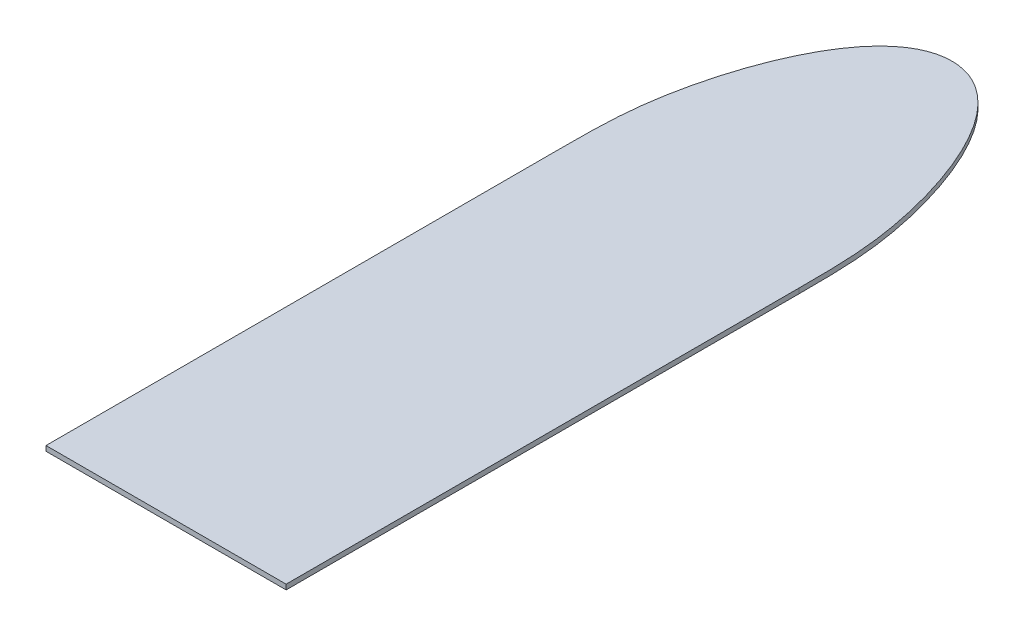
from build123d import *

# Parameters (mm, degrees)
BOSS_EXTRUDE1_DEPTH = 5.842
SKETCH4_W           = 139.7
SKETCH4_H           = 927.1
CUT_EXTRUDE1_DEPTH  = 1468.177722461


with BuildPart() as part:
    # Sketch3 → Boss-Extrude1 (new body)
    with BuildSketch(Plane(origin=(0, 0, 0), x_dir=(1, 0, 0), z_dir=(0, 1, 0))):
        with BuildLine():
            Line((0, 381), (0, -1460.5))
            add(Edge.make_bspline(
                [(0, -1460.5), (108.684994241, -1460.5), (137.201191705, -1361.385263755), (139.7, -1312.037784968), (139.7, -1270)],
                knots=[0, 0, 0, 0, 0.140310505, 0.200610012, 0.200610012, 0.200610012, 0.200610012], degree=3))
            Line((139.7, -1270), (139.7, 63.5))
            add(Edge.make_bspline(
                [(139.7, 63.5), (139.7, 105.409860509), (138.775867716, 206.495657368), (73.507849515, 381), (0, 381)],
                knots=[0.803817555, 0.803817555, 0.803817555, 0.803817555, 0.866735408, 1, 1, 1, 1], degree=3))
        make_face()
    extrude(amount=BOSS_EXTRUDE1_DEPTH)

    # Sketch4 → Cut-Extrude1 (cut, through all)
    with BuildSketch(Plane(origin=(0, 0, 0), x_dir=(1, 0, 0), z_dir=(0, 1, 0))):
        with Locations((69.85, -996.95)):
            Rectangle(SKETCH4_W, SKETCH4_H)
    extrude(amount=CUT_EXTRUDE1_DEPTH, mode=Mode.SUBTRACT)

    # Mirror1: part across plane


with BuildPart() as part_1:
    add(part.part)
    add(part.part.mirror(Plane(origin=(0, 0, 0), x_dir=(0, 0, 1), z_dir=(1, 0, 0))))


solid = part_1.part
